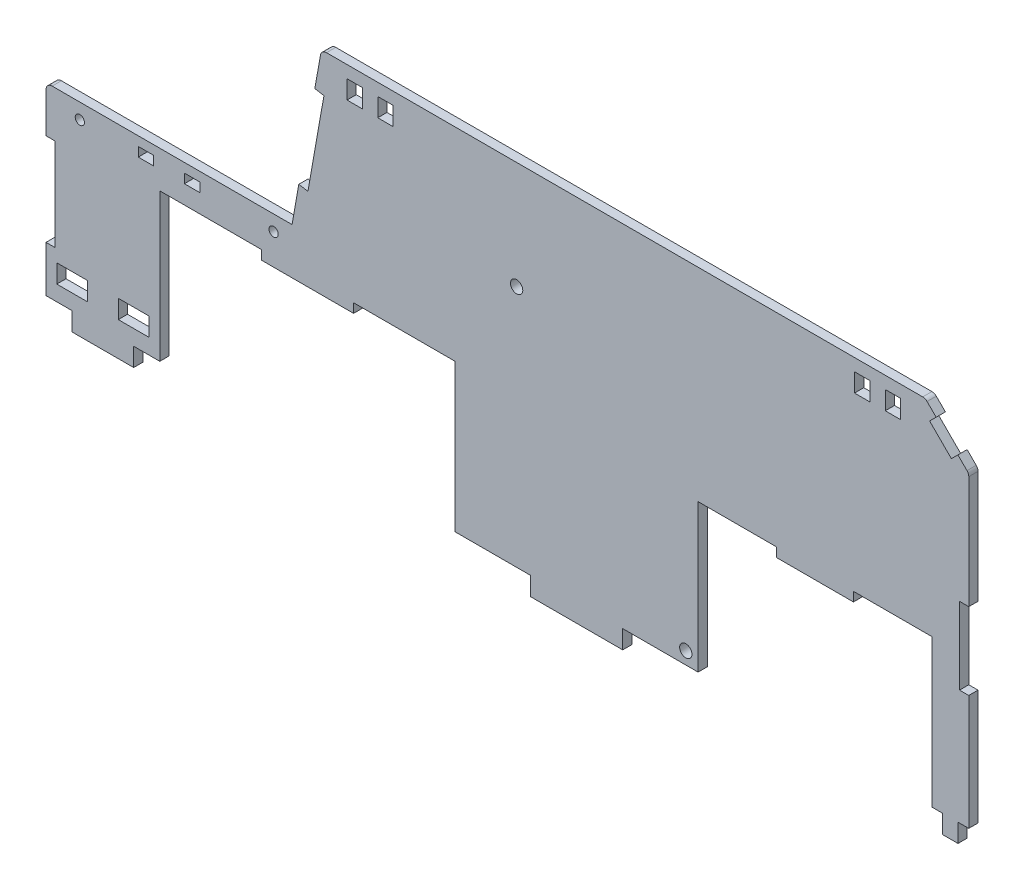
from build123d import *

# Parameters (mm, degrees)
BOSS_EXTRUDE1_DEPTH     = 3
SKETCH2_R               = 2
CUT_EXTRUDE1_DEPTH      = 321.943920335
CUT_EXTRUDE2_DEPTH      = 321.943920335
CUT_EXTRUDE2_DEPTH_BACK = 321.943920335
SKETCH3_W               = 3
SKETCH3_H               = 30
SKETCH4_W               = 10
SKETCH4_H               = 6
CUT_EXTRUDE3_DEPTH      = 321.943920335
SKETCH5_R               = 1.5
SKETCH5_W               = 5
SKETCH5_H               = 3
CUT_EXTRUDE4_DEPTH      = 321.943920335
SKETCH6_W               = 5
SKETCH6_H               = 6
CUT_EXTRUDE5_DEPTH      = 321.943920335
FILLET1_R               = 2


with BuildPart() as part:
    # Sketch1 → Boss-Extrude1 (new body)
    with BuildSketch(Plane.XY):
        Polygon((0, 0), (8.5, 0), (8.5, -6), (28.5, -6), (28.5, 0), (37, 0), (37, 48), (70, 48), (70, 45), (100, 45), (100, 48), (133, 48), (133, 0), (157.5, 0), (157.5, -6), (187.5, -6), (187.5, 0), (212, 0), (212, 48), (237.5, 48), (237.5, 45), (262.5, 45), (262.5, 48), (288, 48), (288, 0), (291.5, 0), (291.5, -6), (296.5, -6), (296.5, 0), (300, 0), (300, 37.428932188), (297, 37.428932188), (297, 62.428932188), (300, 62.428932188), (300, 99.857864376), (296.464466094, 103.393398282), (294.343145751, 101.272077939), (287.272077939, 108.343145751), (289.393398282, 110.464466094), (285.857864376, 114), (89.521656958, 114), (80, 60), (0, 60), align=None)
    extrude(amount=BOSS_EXTRUDE1_DEPTH)

    # Sketch2 → Cut-Extrude1 (cut, through all)
    with BuildSketch(Plane(origin=(0, 0, 0), x_dir=(-1, 0, 0), z_dir=(0, 0, -1))):
        with Locations((-208, 4)):
            Circle(SKETCH2_R)
        with Locations((-153, 79)):
            Circle(SKETCH2_R)
    extrude(amount=-CUT_EXTRUDE1_DEPTH, mode=Mode.SUBTRACT)

    # Sketch3 → Cut-Extrude2 (cut, two sides: drawn at the far end of the back side and taken through both)
    with BuildSketch(Plane(origin=(0, 0, 0), x_dir=(-1, 0, 0), z_dir=(0, 0, -1)).offset(-CUT_EXTRUDE2_DEPTH_BACK)):
        Polygon((-87.40573319, 102), (-90.360156449, 101.479055467), (-85.150711119, 71.934822877), (-82.19628786, 72.45576741), align=None)
        with Locations((-1.5, 30)):
            Rectangle(SKETCH3_W, SKETCH3_H)
    extrude(amount=CUT_EXTRUDE2_DEPTH + CUT_EXTRUDE2_DEPTH_BACK, mode=Mode.SUBTRACT)

    # Sketch4 → Cut-Extrude3 (cut, through all)
    with BuildSketch(Plane(origin=(0, 0, 0), x_dir=(-1, 0, 0), z_dir=(0, 0, -1))):
        with Locations((-28.5, 8)):
            Rectangle(SKETCH4_W, SKETCH4_H)
        with Locations((-8.5, 8)):
            Rectangle(SKETCH4_W, SKETCH4_H)
    extrude(amount=-CUT_EXTRUDE3_DEPTH, mode=Mode.SUBTRACT)

    # Sketch5 → Cut-Extrude4 (cut, through all)
    with BuildSketch(Plane(origin=(0, 0, 0), x_dir=(-1, 0, 0), z_dir=(0, 0, -1))):
        with Locations((-11, 55)):
            Circle(SKETCH5_R)
        with Locations((-74, 55)):
            Circle(SKETCH5_R)
        with Locations((-47.5, 55.5)):
            Rectangle(SKETCH5_W, SKETCH5_H)
        with Locations((-32.5, 55.5)):
            Rectangle(SKETCH5_W, SKETCH5_H)
    extrude(amount=-CUT_EXTRUDE4_DEPTH, mode=Mode.SUBTRACT)

    # Sketch6 → Cut-Extrude5 (cut, through all)
    with BuildSketch(Plane(origin=(0, 0, 0), x_dir=(-1, 0, 0), z_dir=(0, 0, -1))):
        with Locations((-275.357864376, 107)):
            Rectangle(SKETCH6_W, SKETCH6_H)
        with Locations((-265.357864376, 107)):
            Rectangle(SKETCH6_W, SKETCH6_H)
        with Locations((-110.357864376, 107)):
            Rectangle(SKETCH6_W, SKETCH6_H)
        with Locations((-100.357864376, 107)):
            Rectangle(SKETCH6_W, SKETCH6_H)
    extrude(amount=-CUT_EXTRUDE5_DEPTH, mode=Mode.SUBTRACT)

    # Fillet1
    fillet1_edges = [part.edges().sort_by_distance(p)[0] for p in [
        (0, 60, 1.5),
        (89.521656958, 114, 1.5),
        (285.857864376, 114, 1.5),
        (300, 99.857864376, 1.5),
    ]]
    fillet(fillet1_edges, radius=FILLET1_R)


solid = part.part
